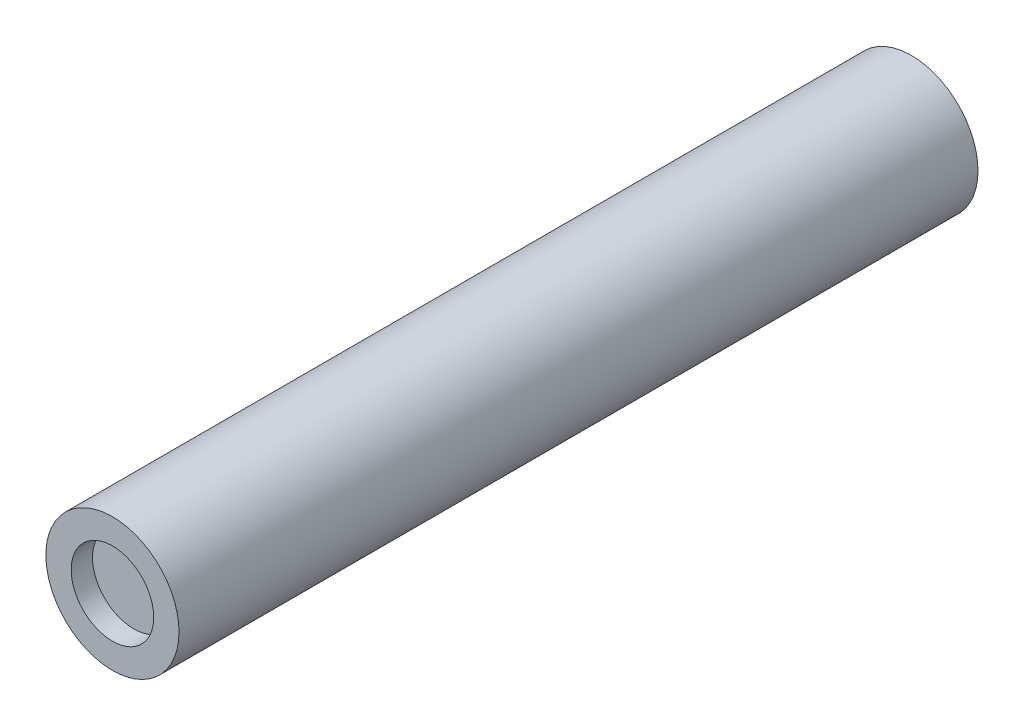
from build123d import *

# Parameters (mm, degrees)
ESBO_O1_R                = 5
RESSALTO_EXTRUS_O1_DEPTH = 60
ESBO_O2_R                = 3.1
CORTE_EXTRUS_O1_DEPTH    = 1.6
CORTE_EXTRUS_O2_START    = -1.6
ESBO_O4_R                = 3.1
CORTE_EXTRUS_O2_DEPTH    = 1.6


with BuildPart() as part:
    # Esboço1 → Ressalto-extrusão1 (new body)
    with BuildSketch(Plane.XY):
        with Locations((-47.06210916, 23.31464497)):
            Circle(ESBO_O1_R)
    extrude(amount=RESSALTO_EXTRUS_O1_DEPTH)

    # Esboço2 → Corte-extrusão1 (cut)
    with BuildSketch(Plane.XY.offset(60)):
        with Locations((-47.06210916, 23.31464497)):
            Circle(ESBO_O2_R)
    extrude(amount=-CORTE_EXTRUS_O1_DEPTH, mode=Mode.SUBTRACT)

    # Esboço4 → Corte-extrusão2 (cut)
    with BuildSketch(Plane(origin=(0, 0, 0), x_dir=(-1, 0, 0), z_dir=(0, 0, -1)).offset(CORTE_EXTRUS_O2_START)):
        with Locations(Location((47.06210916, 23.31464497, 0), (0, 0, 180))):
            Circle(ESBO_O4_R)
    extrude(amount=CORTE_EXTRUS_O2_DEPTH, mode=Mode.SUBTRACT)


solid = part.part
